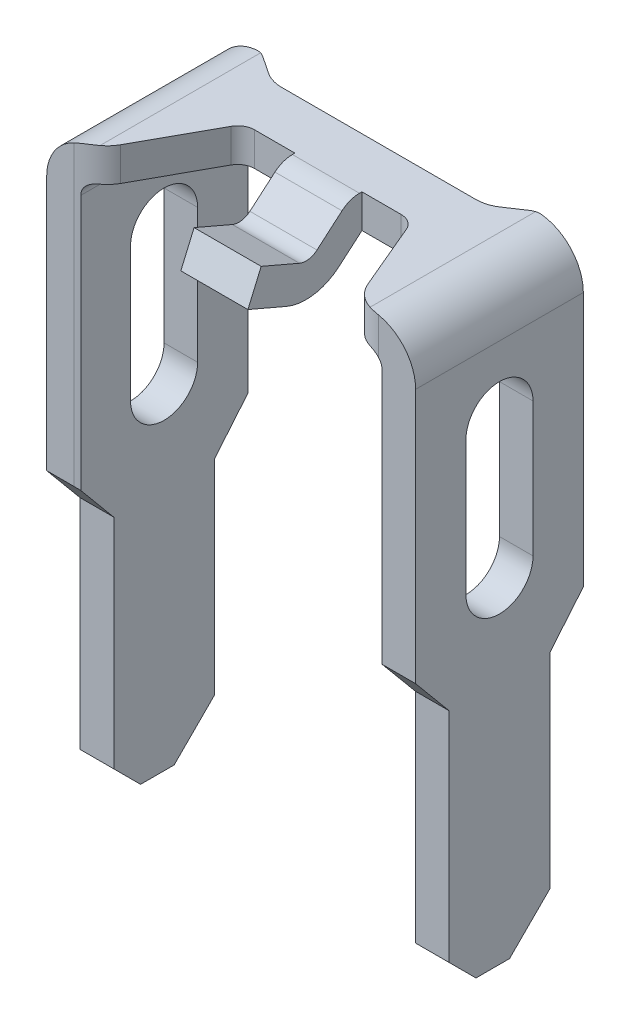
from build123d import *

# Parameters (mm, degrees)
BOSS_EXTRUDE1_DEPTH = 2.5
CUT_EXTRUDE1_DEPTH  = 10.5
FILLET1_R           = 0.25
CUT_EXTRUDE2_DEPTH  = 5.25
BOSS_EXTRUDE2_DEPTH = 0.5
CHAMFER1_SIZE       = 0.6
CHAMFER2_SIZE       = 0.4


with BuildPart() as part:
    # Sketch1 → Boss-Extrude1 (new body)
    with BuildSketch(Plane.XY):
        with BuildLine():
            Line((-2.75, -4), (-2.75, 4.05))
            ThreePointArc((-2.75, 4.05), (-2.544974747, 4.544974747), (-2.05, 4.75))
            Line((-2.05, 4.75), (2.05, 4.75))
            ThreePointArc((2.05, 4.75), (2.544974747, 4.544974747), (2.75, 4.05))
            Line((2.75, 4.05), (2.75, -4))
            Line((2.75, -4), (2.25, -4))
            Line((2.25, -4), (2.25, 4.05))
            ThreePointArc((2.25, 4.05), (2.191421356, 4.191421356), (2.05, 4.25))
            Line((2.05, 4.25), (-2.05, 4.25))
            ThreePointArc((-2.05, 4.25), (-2.191421356, 4.191421356), (-2.25, 4.05))
            Line((-2.25, 4.05), (-2.25, -4))
            Line((-2.25, -4), (-2.75, -4))
        make_face()
    extrude(amount=BOSS_EXTRUDE1_DEPTH)

    # Sketch2 → Cut-Extrude1 (cut)
    with BuildSketch(Plane(origin=(0, 4.75, 0), x_dir=(1, 0, 0), z_dir=(0, 1, 0))):
        with BuildLine():
            Line((-2.05, 0), (-1.725962279, -0.216025147))
            ThreePointArc((-1.725962279, -0.216025147), (-1.593504255, -0.278546013), (-1.448612181, -0.3))
            Line((-1.448612181, -0.3), (1.448612181, -0.3))
            ThreePointArc((1.448612181, -0.3), (1.593504255, -0.278546013), (1.725962279, -0.216025147))
            Line((1.725962279, -0.216025147), (2.05, 0))
            Line((2.05, 0), (2.05, 0.547519398))
            Line((2.05, 0.547519398), (-2.05, 0.547519398))
            Line((-2.05, 0.547519398), (-2.05, 0))
        make_face()
        with BuildLine():
            Line((-2.75, -2.5), (-2.345189488, -2.5))
            ThreePointArc((-2.345189488, -2.5), (-2.090994028, -2.430563198), (-1.907400646, -2.241538671))
            Line((-1.907400646, -2.241538671), (-1.321299677, -1.179230664))
            ThreePointArc((-1.321299677, -1.179230664), (-1.229502986, -1.084718401), (-1.102405256, -1.05))
            Line((-1.102405256, -1.05), (1.084290526, -1.05))
            ThreePointArc((1.084290526, -1.05), (1.222412736, -1.091619926), (1.314545856, -1.202621958))
            Line((1.314545856, -1.202621958), (1.734132573, -2.194756083))
            ThreePointArc((1.734132573, -2.194756083), (1.918398814, -2.416760148), (2.194643233, -2.5))
            Line((2.194643233, -2.5), (2.75, -2.5))
            Line((2.75, -2.5), (2.75, -3.056093585))
            Line((2.75, -3.056093585), (-2.75, -3.056093585))
            Line((-2.75, -3.056093585), (-2.75, -2.5))
        make_face()
    extrude(amount=-CUT_EXTRUDE1_DEPTH, mode=Mode.SUBTRACT)

    # Fillet1
    fillet1_edges = [part.edges().sort_by_distance(p)[0] for p in [
        (-2.05, 4.5, 0),
        (2.05, 4.5, 0),
    ]]
    fillet(fillet1_edges, radius=FILLET1_R)

    # Sketch3 → Cut-Extrude2 (cut, symmetric)
    with BuildSketch(Plane(origin=(0, 0, 0), x_dir=(0, 0, -1), z_dir=(1, 0, 0))):
        Polygon((0, 0.25), (-0.5, -0.35), (-0.5, -4.396314828), (0.876390697, -4.396314828), (0.876390697, 0.25), align=None)
        Polygon((-2.5, 0.25), (-2, -0.35), (-2, -4.896314828), (-3.070294312, -4.896314828), (-3.070294312, 0.25), align=None)
        with BuildLine():
            Line((-0.75, 3.024565065), (-0.75, 1.024565065))
            ThreePointArc((-0.75, 1.024565065), (-1.25, 0.524565065), (-1.75, 1.024565065))
            Line((-1.75, 1.024565065), (-1.75, 3.024565065))
            ThreePointArc((-1.75, 3.024565065), (-1.25, 3.524565065), (-0.75, 3.024565065))
        make_face()
    extrude(amount=CUT_EXTRUDE2_DEPTH, both=True, mode=Mode.SUBTRACT)

    # Sketch4 → Boss-Extrude2 (add, symmetric)
    with BuildSketch(Plane(origin=(0, 0, 0), x_dir=(0, 0, -1), z_dir=(1, 0, 0))):
        with BuildLine():
            Line((-1.05, 4.25), (-1.395169213, 3.954140675))
            ThreePointArc((-1.395169213, 3.954140675), (-1.770160684, 3.782160221), (-2.179373497, 3.834512432))
            Line((-2.179373497, 3.834512432), (-2.75, 4.079724782))
            Line((-2.75, 4.079724782), (-2.552592831, 4.539105245))
            Line((-2.552592831, 4.539105245), (-1.981966328, 4.293892895))
            ThreePointArc((-1.981966328, 4.293892895), (-1.845562057, 4.276442158), (-1.7205649, 4.333768976))
            Line((-1.7205649, 4.333768976), (-1.347308957, 4.653702641))
            ThreePointArc((-1.347308957, 4.653702641), (-1.225770907, 4.725154006), (-1.086992408, 4.75))
            Line((-1.086992408, 4.75), (-1.05, 4.75))
            Line((-1.05, 4.75), (-1.05, 4.25))
        make_face()
    extrude(amount=BOSS_EXTRUDE2_DEPTH, both=True)

    # Chamfer1
    chamfer1_edges = [part.edges().sort_by_distance(p)[0] for p in [
        (2.5, -4, 0.5),
        (-2.5, -4, 0.5),
    ]]
    chamfer(chamfer1_edges, length=CHAMFER1_SIZE)

    # Chamfer2
    chamfer2_edges = [part.edges().sort_by_distance(p)[0] for p in [
        (2.5, -4, 2),
        (-2.5, -4, 2),
    ]]
    chamfer(chamfer2_edges, length=CHAMFER2_SIZE)


solid = part.part
